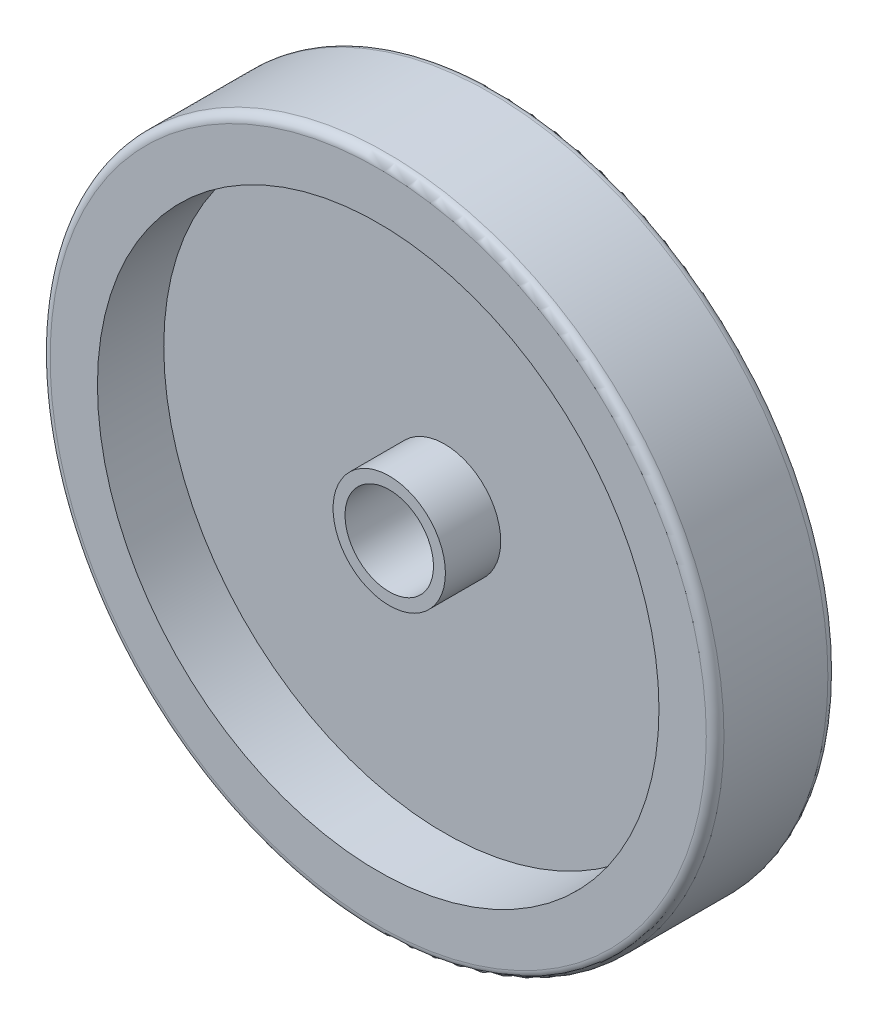
from build123d import *

# Parameters (mm, degrees)
SKETCH1_R           = 76.2
SKETCH1_R_2         = 50.8
SKETCH1_R_3         = 10
BOSS_EXTRUDE2_DEPTH = 25
SKETCH3_R           = 76.2
SKETCH3_R_2         = 12.7
CUT_EXTRUDE1_DEPTH  = 12.5
SKETCH4_R           = 76.2
SKETCH4_R_2         = 63.5
BOSS_EXTRUDE3_DEPTH = 15
FILLET2_R           = 2


with BuildPart() as part:
    # Sketch1 → Boss-Extrude2 (new body)
    # profile 1 of 2: a face of its own
    with BuildSketch(Plane.XY):
        Circle(SKETCH1_R)
        Circle(SKETCH1_R_2, mode=Mode.SUBTRACT)
    # profile 2 of 2: a face of its own
    with BuildSketch(Plane.XY):
        Circle(SKETCH1_R_2)
        Circle(SKETCH1_R_3, mode=Mode.SUBTRACT)
    extrude(amount=BOSS_EXTRUDE2_DEPTH)

    # Sketch3 → Cut-Extrude1 (cut, symmetric)
    with BuildSketch(Plane.XY.offset(25)):
        Circle(SKETCH3_R)
        Circle(SKETCH3_R_2, mode=Mode.SUBTRACT)
    extrude(amount=CUT_EXTRUDE1_DEPTH, both=True, mode=Mode.SUBTRACT)

    # Sketch4 → Boss-Extrude3 (add)
    with BuildSketch(Plane.XY.offset(12.5)):
        Circle(SKETCH4_R)
        Circle(SKETCH4_R_2, mode=Mode.SUBTRACT)
    extrude(amount=BOSS_EXTRUDE3_DEPTH)

    # Fillet2
    fillet2_edges = [part.edges().sort_by_distance(p)[0] for p in [
        (-76.2, 0, 27.5),
        (-76.2, 0, 0),
    ]]
    fillet(fillet2_edges, radius=FILLET2_R)


solid = part.part
